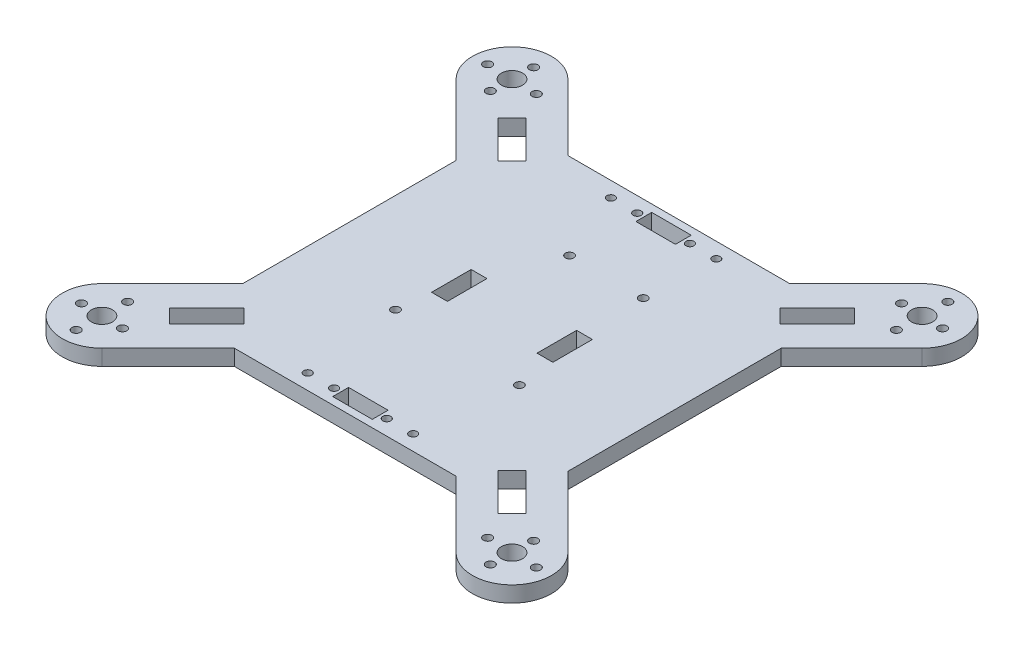
from build123d import *

# Parameters (mm, degrees)
SKETCH1_R               = 15
SKETCH1_R_2             = 4
BOSS_EXTRUDE1_DEPTH     = 6
SKETCH5_R               = 1.5875
BOSS_EXTRUDE2_DEPTH     = 6
SKETCH5_3_R             = 1.5875
CUT_EXTRUDE1_DEPTH      = 132.350313117
CUT_EXTRUDE2_START      = -6
SKETCH6_R               = 1.625
SKETCH6_R_2             = 4
CUT_EXTRUDE2_DEPTH      = 6
BOSS_EXTRUDE3_DEPTH     = 6
CUT_EXTRUDE7_DEPTH      = 6
CUT_EXTRUDE7_DEPTH_BACK = 132.350313117
SKETCH8_R               = 1.5
SKETCH8_W               = 15
SKETCH8_H               = 6
SKETCH8_W_2             = 6
SKETCH8_H_2             = 15
CUT_EXTRUDE9_DEPTH      = 132.350313117


with BuildPart() as part:
    # Sketch1 → Boss-Extrude1 (new body)
    # profile 1 of 9: a face of its own
    with BuildSketch(Plane(origin=(0, 0, 0), x_dir=(1, 0, 0), z_dir=(0, 1, 0))):
        with Locations((-77.781745931, 77.781745931)):
            Circle(SKETCH1_R)
        with Locations(Location((-77.781745931, 77.781745931, 0), (0, 0, 270))):
            Circle(SKETCH1_R_2, mode=Mode.SUBTRACT)
    # profile 2 of 9: a face of its own
    with BuildSketch(Plane(origin=(0, 0, 0), x_dir=(1, 0, 0), z_dir=(0, 1, 0))):
        with BuildLine():
            Line((0, 21.213203436), (-67.175144213, 88.388347648))
            ThreePointArc((-67.175144213, 88.388347648), (-63.923552943, 83.521997416), (-62.781745931, 77.781745931))
            ThreePointArc((-62.781745931, 77.781745931), (-72.041494445, 63.923552943), (-88.388347648, 67.175144213))
            Line((-88.388347648, 67.175144213), (-21.213203436, 0))
            Line((-21.213203436, 0), (0, 21.213203436))
        make_face()
    # profile 3 of 9: a face of its own
    with BuildSketch(Plane(origin=(0, 0, 0), x_dir=(1, 0, 0), z_dir=(0, 1, 0))):
        with Locations((-77.781745931, -77.781745931)):
            Circle(SKETCH1_R)
        with Locations(Location((-77.781745931, -77.781745931, 0), (0, 0, 270))):
            Circle(SKETCH1_R_2, mode=Mode.SUBTRACT)
    # profile 4 of 9: a face of its own
    with BuildSketch(Plane(origin=(0, 0, 0), x_dir=(1, 0, 0), z_dir=(0, 1, 0))):
        with BuildLine():
            Line((0, -21.213203436), (-21.213203436, 0))
            Line((-21.213203436, 0), (-88.388347648, -67.175144213))
            ThreePointArc((-88.388347648, -67.175144213), (-72.041494445, -63.923552943), (-62.781745931, -77.781745931))
            ThreePointArc((-62.781745931, -77.781745931), (-63.923552943, -83.521997416), (-67.175144213, -88.388347648))
            Line((-67.175144213, -88.388347648), (0, -21.213203436))
        make_face()
    # profile 5 of 9: a face of its own
    with BuildSketch(Plane(origin=(0, 0, 0), x_dir=(1, 0, 0), z_dir=(0, 1, 0))):
        with BuildLine():
            Line((88.388347648, -67.175144213), (21.213203436, 0))
            Line((21.213203436, 0), (0, -21.213203436))
            Line((0, -21.213203436), (67.175144213, -88.388347648))
            ThreePointArc((67.175144213, -88.388347648), (67.175144213, -67.175144213), (88.388347648, -67.175144213))
        make_face()
    # profile 6 of 9: a face of its own
    with BuildSketch(Plane(origin=(0, 0, 0), x_dir=(1, 0, 0), z_dir=(0, 1, 0))):
        with BuildLine():
            Line((67.175144213, 88.388347648), (0, 21.213203436))
            Line((0, 21.213203436), (21.213203436, 0))
            Line((21.213203436, 0), (88.388347648, 67.175144213))
            ThreePointArc((88.388347648, 67.175144213), (67.175144213, 67.175144213), (67.175144213, 88.388347648))
        make_face()
    # profile 7 of 9: a face of its own
    with BuildSketch(Plane(origin=(0, 0, 0), x_dir=(1, 0, 0), z_dir=(0, 1, 0))):
        Polygon((21.213203436, 0), (0, 21.213203436), (-21.213203436, 0), (0, -21.213203436), align=None)
    # profile 8 of 9: a face of its own
    with BuildSketch(Plane(origin=(0, 0, 0), x_dir=(1, 0, 0), z_dir=(0, 1, 0))):
        with Locations((77.781745931, -77.781745931)):
            Circle(SKETCH1_R)
        with Locations(Location((77.781745931, -77.781745931, 0), (0, 0, 270))):
            Circle(SKETCH1_R_2, mode=Mode.SUBTRACT)
    # profile 9 of 9: a face of its own
    with BuildSketch(Plane(origin=(0, 0, 0), x_dir=(1, 0, 0), z_dir=(0, 1, 0))):
        with Locations((77.781745931, 77.781745931)):
            Circle(SKETCH1_R)
        with Locations(Location((77.781745931, 77.781745931, 0), (0, 0, 270))):
            Circle(SKETCH1_R_2, mode=Mode.SUBTRACT)
    extrude(amount=BOSS_EXTRUDE1_DEPTH)

    # Sketch5 → Boss-Extrude2 (add)
    # profile 1 of 7: a face of its own
    with BuildSketch(Plane(origin=(0, 6, 0), x_dir=(1, 0, 0), z_dir=(0, 1, 0))):
        with BuildLine():
            Line((-10.282376441, 31.495579877), (-8.127477307, 29.340680742))
            ThreePointArc((-8.127477307, 29.340680742), (-7.524227144, 29.923845457), (-7.302497429, 30.733059754))
            ThreePointArc((-7.302497429, 30.733059754), (-8.496452915, 32.271006101), (-10.282376441, 31.495579877))
        make_face()
    # profile 2 of 7: a face of its own
    with BuildSketch(Plane(origin=(0, 6, 0), x_dir=(1, 0, 0), z_dir=(0, 1, 0))):
        with BuildLine():
            ThreePointArc((-10.282376441, 31.495579877), (-10.012529444, 29.610527739), (-8.127477307, 29.340680742))
            Line((-8.127477307, 29.340680742), (-10.282376441, 31.495579877))
        make_face()
    # profile 3 of 7: a face of its own
    with BuildSketch(Plane(origin=(0, 6, 0), x_dir=(1, 0, 0), z_dir=(0, 1, 0))):
        with BuildLine():
            Line((14.093737222, -35.306940657), (26.67, -35.306940784))
            Line((26.67, -35.306940784), (26.670001162, -5.456797726))
            Line((26.670001162, -5.456797726), (21.213203436, 0))
            Line((21.213203436, 0), (26.670001587, 5.456798151))
            Line((26.670001587, 5.456798151), (26.670002571, 30.733059754))
            Line((26.670002571, 30.733059754), (24.130002571, 30.733059754))
            Line((24.130002571, 30.733059754), (21.590002571, 33.273059754))
            Line((21.590002571, 33.273059754), (12.059856318, 33.273059754))
            Line((12.059856318, 33.273059754), (0, 21.213203436))
            Line((0, 21.213203436), (-8.127477307, 29.340680742))
            ThreePointArc((-8.127477307, 29.340680742), (-10.012529444, 29.610527739), (-10.282376441, 31.495579877))
            Line((-10.282376441, 31.495579877), (-11.617926874, 32.831130309))
            Line((-11.617926874, 32.831130309), (-13.715997429, 30.733059754))
            Line((-13.715997429, 30.733059754), (-26.669997429, 30.733059754))
            Line((-26.669997429, 30.733059754), (-26.669998413, 5.456794978))
            Line((-26.669998413, 5.456794978), (-21.213203436, 0))
            Line((-21.213203436, 0), (-26.669998838, -5.456795402))
            Line((-26.669998838, -5.456795402), (-26.67, -35.306940246))
            Line((-26.67, -35.306940246), (-14.093736937, -35.306940373))
            Line((-14.093736937, -35.306940373), (0, -21.213203436))
            Line((0, -21.213203436), (14.093737222, -35.306940657))
        make_face()
        with Locations((-24.129999407, -20.066940272)):
            Circle(SKETCH5_R, mode=Mode.SUBTRACT)
        with Locations((24.130000544, -21.336940759)):
            Circle(SKETCH5_R, mode=Mode.SUBTRACT)
        with Locations((19.050002571, 30.733059754)):
            Circle(SKETCH5_R, mode=Mode.SUBTRACT)
    # profile 4 of 7: a face of its own
    with BuildSketch(Plane(origin=(0, 6, 0), x_dir=(1, 0, 0), z_dir=(0, 1, 0))):
        Polygon((-26.669998413, 5.456794978), (-26.669998838, -5.456795402), (-21.213203436, 0), align=None)
    # profile 5 of 7: a face of its own
    with BuildSketch(Plane(origin=(0, 6, 0), x_dir=(1, 0, 0), z_dir=(0, 1, 0))):
        Polygon((21.213203436, 0), (26.670001162, -5.456797726), (26.670001587, 5.456798151), align=None)
    # profile 6 of 7: a face of its own
    with BuildSketch(Plane(origin=(0, 6, 0), x_dir=(1, 0, 0), z_dir=(0, 1, 0))):
        Polygon((-14.093736937, -35.306940373), (14.093737222, -35.306940657), (0, -21.213203436), align=None)
    # profile 7 of 7: a face of its own
    with BuildSketch(Plane(origin=(0, 6, 0), x_dir=(1, 0, 0), z_dir=(0, 1, 0))):
        with BuildLine():
            Line((0, 21.213203436), (12.059856318, 33.273059754))
            Line((12.059856318, 33.273059754), (-11.175997429, 33.273059754))
            Line((-11.175997429, 33.273059754), (-11.617926874, 32.831130309))
            Line((-11.617926874, 32.831130309), (-10.282376441, 31.495579877))
            ThreePointArc((-10.282376441, 31.495579877), (-8.496452915, 32.271006101), (-7.302497429, 30.733059754))
            ThreePointArc((-7.302497429, 30.733059754), (-7.524227144, 29.923845457), (-8.127477307, 29.340680742))
            Line((-8.127477307, 29.340680742), (0, 21.213203436))
        make_face()
    extrude(amount=-BOSS_EXTRUDE2_DEPTH)

    # Sketch5<3> → Cut-Extrude1 (cut, through all)
    with BuildSketch(Plane(origin=(0, 6, 0), x_dir=(1, 0, 0), z_dir=(0, 1, 0))):
        with Locations(Location((19.050002571, 30.733059754, 0), (0, 0, 270))):
            Circle(SKETCH5_3_R)
        with Locations(Location((-8.889997429, 30.733059754, 0), (0, 0, 270))):
            Circle(SKETCH5_3_R)
        with Locations(Location((24.130000544, -21.336940759, 0), (0, 0, 270))):
            Circle(SKETCH5_3_R)
        with Locations(Location((-24.129999407, -20.066940272, 0), (0, 0, 270))):
            Circle(SKETCH5_3_R)
    extrude(amount=-CUT_EXTRUDE1_DEPTH, mode=Mode.SUBTRACT)

    # Sketch6 → Cut-Extrude2 (cut)
    with BuildSketch(Plane(origin=(0, 6, 0), x_dir=(1, 0, 0), z_dir=(0, 1, 0)).offset(CUT_EXTRUDE2_START)):
        with Locations(Location((-69.784824646, -78.003669268, 0), (0, 0, 270))):
            Circle(SKETCH6_R)
        with Locations(Location((-78.045279894, -87.278089956, 0), (0, 0, 270))):
            Circle(SKETCH6_R)
        with Locations(Location((-77.518211967, -68.285401905, 0), (0, 0, 270))):
            Circle(SKETCH6_R)
        with Locations(Location((-85.778667215, -77.559822593, 0), (0, 0, 270))):
            Circle(SKETCH6_R)
        with Locations(Location((-77.781745931, -77.781745931, 0), (0, 0, 270))):
            Circle(SKETCH6_R_2)
        with Locations(Location((68.285401905, -77.518211967, 0), (0, 0, 270))):
            Circle(SKETCH6_R)
        with Locations(Location((87.278089956, -78.045279894, 0), (0, 0, 270))):
            Circle(SKETCH6_R)
        with Locations(Location((78.003669268, -69.784824646, 0), (0, 0, 270))):
            Circle(SKETCH6_R)
        with Locations(Location((77.559822593, -85.778667215, 0), (0, 0, 270))):
            Circle(SKETCH6_R)
        with Locations(Location((-87.278089956, 78.045279894, 0), (0, 0, 270))):
            Circle(SKETCH6_R)
        with Locations(Location((-77.559822593, 85.778667215, 0), (0, 0, 270))):
            Circle(SKETCH6_R)
        with Locations(Location((-78.003669268, 69.784824646, 0), (0, 0, 270))):
            Circle(SKETCH6_R)
        with Locations(Location((-68.285401905, 77.518211967, 0), (0, 0, 270))):
            Circle(SKETCH6_R)
        with Locations(Location((78.045279894, 87.278089956, 0), (0, 0, 270))):
            Circle(SKETCH6_R)
        with Locations(Location((77.518211967, 68.285401905, 0), (0, 0, 270))):
            Circle(SKETCH6_R)
        with Locations(Location((85.778667215, 77.559822593, 0), (0, 0, 270))):
            Circle(SKETCH6_R)
        with Locations(Location((69.784824646, 78.003669268, 0), (0, 0, 270))):
            Circle(SKETCH6_R)
    extrude(amount=CUT_EXTRUDE2_DEPTH, mode=Mode.SUBTRACT)

    # Sketch7 → Boss-Extrude3 (add)
    with BuildSketch(Plane(origin=(0, 6, 0), x_dir=(1, 0, 0), z_dir=(0, 1, 0))):
        Polygon((61.669998838, -40.456795402), (61.669998838, 40.456795402), (26.670001587, 5.456798151), (26.670001162, -5.456797726), align=None)
        Polygon((-61.669998838, -40.456795402), (-26.669998838, -5.456795402), (-26.669998413, 5.456794978), (-61.669998838, 40.456795402), align=None)
        Polygon((42.059856318, -63.273059754), (14.093737222, -35.306940657), (-14.093736937, -35.306940373), (-42.059856318, -63.273059754), align=None)
        Polygon((-42.059856318, 63.273059754), (-11.617926874, 32.831130309), (-11.175997429, 33.273059754), (12.059856318, 33.273059754), (42.059856318, 63.273059754), align=None)
    extrude(amount=-BOSS_EXTRUDE3_DEPTH)

    # Sketch8 → Cut-Extrude7 (cut, two sides: drawn at the far end of the back side and taken through both)
    with BuildSketch(Plane(origin=(0, 6, 0), x_dir=(1, 0, 0), z_dir=(0, 1, 0)).offset(-CUT_EXTRUDE7_DEPTH_BACK)):
        with Locations(Location((-20, 57.5, 0), (0, 0, 270))):
            Circle(SKETCH8_R)
        with Locations(Location((20, 57.5, 0), (0, 0, 270))):
            Circle(SKETCH8_R)
        with Locations(Location((20, -57.5, 0), (0, 0, 270))):
            Circle(SKETCH8_R)
        with Locations(Location((-20, -57.5, 0), (0, 0, 270))):
            Circle(SKETCH8_R)
        with Locations(Location((-10, 57.5, 0), (0, 0, 270))):
            Circle(SKETCH8_R)
        with Locations(Location((10, 57.5, 0), (0, 0, 270))):
            Circle(SKETCH8_R)
        with Locations(Location((-10, -57.5, 0), (0, 0, 270))):
            Circle(SKETCH8_R)
        with Locations(Location((10, -57.5, 0), (0, 0, 270))):
            Circle(SKETCH8_R)
        with Locations((0, 57.5)):
            Rectangle(SKETCH8_W, SKETCH8_H)
        with Locations((0, -57.5)):
            Rectangle(SKETCH8_W, SKETCH8_H)
        with Locations((-20, 0)):
            Rectangle(SKETCH8_W_2, SKETCH8_H_2)
        with Locations((20, 0)):
            Rectangle(SKETCH8_W_2, SKETCH8_H_2)
    extrude(amount=CUT_EXTRUDE7_DEPTH + CUT_EXTRUDE7_DEPTH_BACK, mode=Mode.SUBTRACT)

    # Sketch9 → Cut-Extrude9 (cut, through all)
    with BuildSketch(Plane(origin=(0, 6, 0), x_dir=(1, 0, 0), z_dir=(0, 1, 0))):
        Polygon((-67.600254781, 62.296953922), (-62.296953922, 67.600254781), (-48.154818298, 53.458119157), (-53.458119157, 48.154818298), align=None)
        Polygon((62.296953922, 67.600254781), (48.154818298, 53.458119157), (53.458119157, 48.154818298), (67.600254781, 62.296953922), align=None)
        Polygon((67.600254781, -62.296953922), (62.296953922, -67.600254781), (48.154818298, -53.458119157), (53.458119157, -48.154818298), align=None)
        Polygon((-62.296953922, -67.600254781), (-48.154818298, -53.458119157), (-53.458119157, -48.154818298), (-67.600254781, -62.296953922), align=None)
    extrude(amount=-CUT_EXTRUDE9_DEPTH, mode=Mode.SUBTRACT)


solid = part.part
